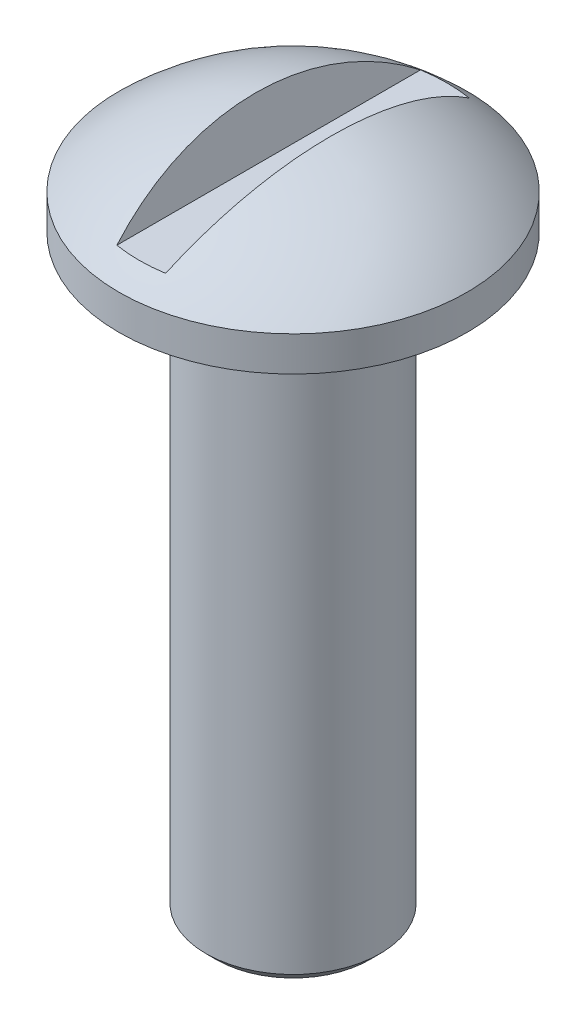
from build123d import *

# Parameters (mm, degrees)
DOME1_FACE_RADIUS       = 12.7
DOME1_HEIGHT            = 5.08
CUT_EXTRUDE2_DEPTH      = 54.881536726
CUT_EXTRUDE2_DEPTH_BACK = 54.881536726
CHAMFER1_SIZE           = 0.762


with BuildPart() as part:
    # Sketch5 → Revolve2 (revolve)
    with BuildSketch(Plane.XY, mode=Mode.PRIVATE) as revolve2_sk:
        Polygon((0, 0), (-6.35, 0), (-6.35, 43.18), (-12.7, 43.18), (-12.7, 45.72), (0, 45.72), (0, 43.18), align=None)
    revolve(revolve2_sk.sketch.rotate(Axis((0, 0, 0), (0, -1, 0)), 270), axis=Axis((0, 0, 0), (0, -1, 0)))

    # Dome1: a dome of height H over a round flat face of radius A is a cap of a sphere of radius (A * A + H * H) / (2 * H)
    dome1_r = (DOME1_FACE_RADIUS * DOME1_FACE_RADIUS + DOME1_HEIGHT * DOME1_HEIGHT) / (2 * DOME1_HEIGHT)
    dome1_base = Plane((0, 45.72, 0), z_dir=(0, 1, 0))
    with Locations(dome1_base.offset(DOME1_HEIGHT - dome1_r)):
        dome1_ball = Sphere(dome1_r, mode=Mode.PRIVATE)
    add(split(dome1_ball, bisect_by=dome1_base, keep=Keep.TOP, mode=Mode.PRIVATE))

    # Sketch7 → Cut-Extrude2 (cut, two sides: drawn at the far end of the back side and taken through both)
    with BuildSketch(Plane.XY.offset(-CUT_EXTRUDE2_DEPTH_BACK)):
        Polygon((-32.713179339, 162.446628615), (-2.742527685, 50.594633903), (-1.776668941, 46.99), (1.776668941, 46.99), (2.742527685, 50.594633903), (32.713179339, 162.446628615), (32.713179339, 394.042040328), (-32.713179339, 394.042040328), align=None)
    extrude(amount=CUT_EXTRUDE2_DEPTH + CUT_EXTRUDE2_DEPTH_BACK, mode=Mode.SUBTRACT)

    # Chamfer1
    chamfer1_edges = [part.edges().sort_by_distance(p)[0] for p in [
        (0, 0, -6.35),
    ]]
    chamfer(chamfer1_edges, length=CHAMFER1_SIZE)


solid = part.part
